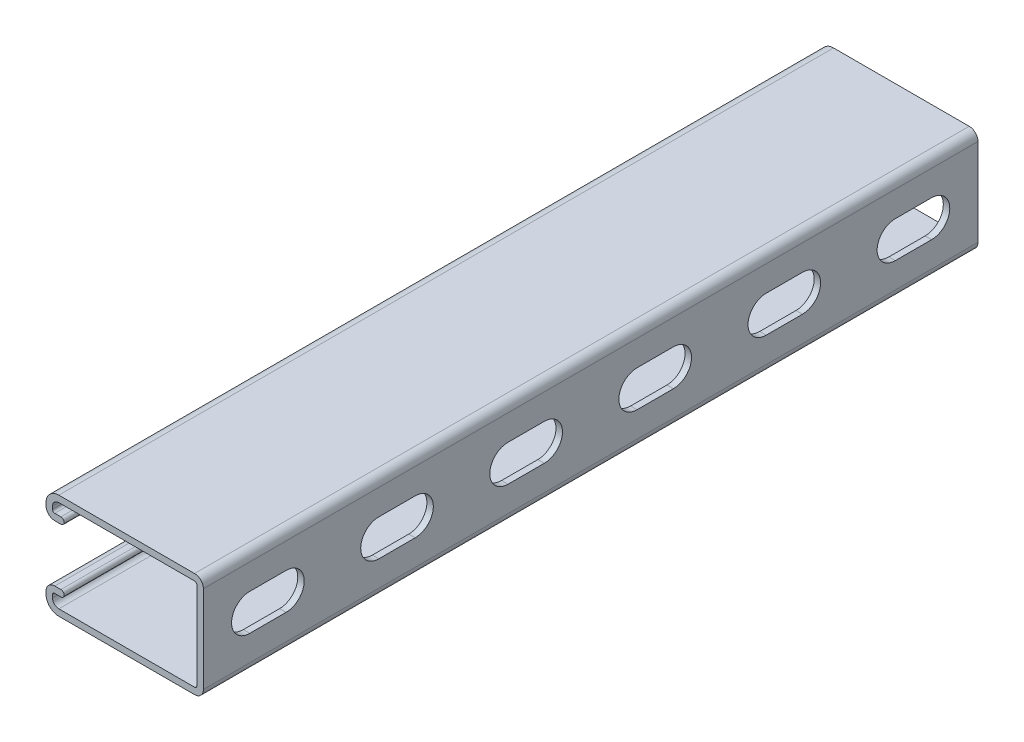
from build123d import *

# Parameters (mm, degrees)
BOSS_EXTRUDE1_DEPTH      = 152.4
BOSS_EXTRUDE1_DEPTH_BACK = 152.4
CUT_EXTRUDE1_DEPTH       = 157.875606199
LPATTERN1_COUNT          = 6
LPATTERN1_PITCH          = 50.8


with BuildPart() as part:
    # Sketch5 → Boss-Extrude1 (new, two sides: drawn at the far end of the back side and taken through both)
    with BuildSketch(Plane.XY.offset(-BOSS_EXTRUDE1_DEPTH_BACK)):
        with BuildLine():
            Line((-25.908, -20.6375), (27.4955, -20.6375))
            ThreePointArc((27.4955, -20.6375), (29.942619793, -19.623869793), (30.95625, -17.17675))
            Line((30.95625, -17.17675), (30.95625, 17.17675))
            ThreePointArc((30.95625, 17.17675), (29.942619793, 19.623869793), (27.4955, 20.6375))
            Line((27.4955, 20.6375), (-25.908, 20.6375))
            ThreePointArc((-25.908, 20.6375), (-29.477651808, 19.158901808), (-30.95625, 15.58925))
            Line((-30.95625, 15.58925), (-30.95625, 14.57325))
            ThreePointArc((-30.95625, 14.57325), (-29.942619793, 12.126130207), (-27.4955, 11.1125))
            Line((-27.4955, 11.1125), (-25.08885, 11.1125))
            ThreePointArc((-25.08885, 11.1125), (-23.81885, 12.3825), (-25.08885, 13.6525))
            Line((-25.08885, 13.6525), (-27.4955, 13.6525))
            ThreePointArc((-27.4955, 13.6525), (-28.146568569, 13.922181431), (-28.41625, 14.57325))
            Line((-28.41625, 14.57325), (-28.41625, 15.58925))
            ThreePointArc((-28.41625, 15.58925), (-27.681600584, 17.362850584), (-25.908, 18.0975))
            Line((-25.908, 18.0975), (27.4955, 18.0975))
            ThreePointArc((27.4955, 18.0975), (28.146568569, 17.827818569), (28.41625, 17.17675))
            Line((28.41625, 17.17675), (28.41625, -17.17675))
            ThreePointArc((28.41625, -17.17675), (28.146568569, -17.827818569), (27.4955, -18.0975))
            Line((27.4955, -18.0975), (-25.908, -18.0975))
            ThreePointArc((-25.908, -18.0975), (-27.681600584, -17.362850584), (-28.41625, -15.58925))
            Line((-28.41625, -15.58925), (-28.41625, -14.57325))
            ThreePointArc((-28.41625, -14.57325), (-28.146568569, -13.922181431), (-27.4955, -13.6525))
            Line((-27.4955, -13.6525), (-25.08885, -13.6525))
            ThreePointArc((-25.08885, -13.6525), (-23.81885, -12.3825), (-25.08885, -11.1125))
            Line((-25.08885, -11.1125), (-27.4955, -11.1125))
            ThreePointArc((-27.4955, -11.1125), (-29.942619793, -12.126130207), (-30.95625, -14.57325))
            Line((-30.95625, -14.57325), (-30.95625, -15.58925))
            ThreePointArc((-30.95625, -15.58925), (-29.477651808, -19.158901808), (-25.908, -20.6375))
        make_face()
    extrude(amount=BOSS_EXTRUDE1_DEPTH + BOSS_EXTRUDE1_DEPTH_BACK)

    # Sketch2 → Cut-Extrude1 (cut, through all)
    with BuildSketch(Plane(origin=(0, 0, 0), x_dir=(0, 0, -1), z_dir=(1, 0, 0))):
        with BuildLine():
            Line((-134.14375, 7.14375), (-119.85625, 7.14375))
            ThreePointArc((-119.85625, 7.14375), (-112.7125, 0), (-119.85625, -7.14375))
            Line((-119.85625, -7.14375), (-134.14375, -7.14375))
            ThreePointArc((-134.14375, -7.14375), (-141.2875, 0), (-134.14375, 7.14375))
        make_face()
    cut_extrude1 = extrude(amount=CUT_EXTRUDE1_DEPTH, mode=Mode.SUBTRACT)

    # LPattern1: Cut-Extrude1 ×6
    with Locations(*[(0, 0, -i * LPATTERN1_PITCH) for i in range(1, LPATTERN1_COUNT)]):
        add(cut_extrude1, mode=Mode.SUBTRACT)


solid = part.part
